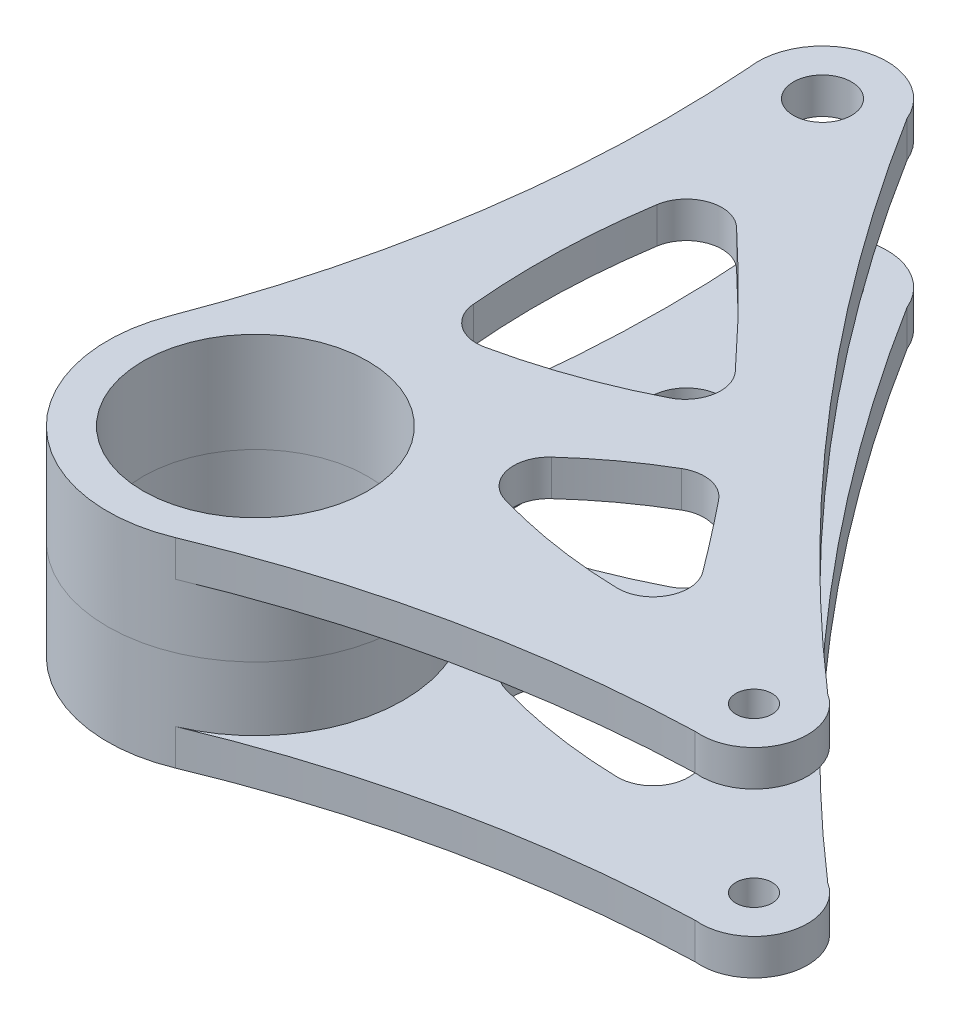
from build123d import *
from build123d.topology import SkipClean

# Parameters (mm, degrees)
SKETCH1_R           = 4.1
SKETCH1_R_2         = 15.8623
SKETCH1_R_3         = 2.55
BOSS_EXTRUDE1_DEPTH = 5.08
CUT_EXTRUDE1_DEPTH  = 118.648778806
FILLET1_R           = 5
BOSS_EXTRUDE2_START = 9
SKETCH2_R           = 15.8623
BOSS_EXTRUDE2_DEPTH = 9


with BuildPart() as part:
    # Sketch1 → Boss-Extrude1 (new body)
    with BuildSketch(Plane(origin=(0, 0, 0), x_dir=(1, 0, 0), z_dir=(0, 1, 0))):
        with BuildLine():
            ThreePointArc((6.92859567, 85.899539138), (-2.50515852, 88.74838161), (-9.001103193, 81.337961625))
            Line((-9.001103193, 81.337961625), (-20.635573093, 3.067357891))
            ThreePointArc((-20.635573093, 3.067357891), (-14.272359364, -15.21628468), (4.380807044, -20.397158894))
            Line((4.380807044, -20.397158894), (70.694507579, -6.154610316))
            ThreePointArc((70.694507579, -6.154610316), (76.259175154, -1.197614881), (74.857557701, 6.121729179))
            Line((74.857557701, 6.121729179), (6.92859567, 85.899539138))
        make_face()
        with Locations((0, 80)):
            Circle(SKETCH1_R, mode=Mode.SUBTRACT)
        Circle(SKETCH1_R_2, mode=Mode.SUBTRACT)
        with Locations((69.109107447, 1.227056598)):
            Circle(SKETCH1_R_3, mode=Mode.SUBTRACT)
    extrude(amount=BOSS_EXTRUDE1_DEPTH)

    # Sketch3 → Cut-Extrude1 (cut, through all)
    with BuildSketch(Plane(origin=(0, 5.08, 0), x_dir=(1, 0, 0), z_dir=(0, 1, 0))):
        with BuildLine():
            Line((74.857557701, 6.121729179), (6.92859567, 85.899539138))
            ThreePointArc((6.92859567, 85.899539138), (7.739936739, 84.785747516), (8.373803599, 83.562220274))
            ThreePointArc((8.373803599, 83.562220274), (37.931231119, 43.187947801), (73.125634893, 7.62002205))
            ThreePointArc((73.125634893, 7.62002205), (74.048734736, 6.936923693), (74.857557701, 6.121729179))
        make_face()
        with BuildLine():
            ThreePointArc((-8.993991676, 78.615040168), (-9.099968964, 79.9762334), (-9.001103193, 81.337961625))
            Line((-9.001103193, 81.337961625), (-20.635573093, 3.067357891))
            ThreePointArc((-20.635573093, 3.067357891), (-20.180913979, 5.28831469), (-19.487953881, 7.446825823))
            ThreePointArc((-19.487953881, 7.446825823), (-10.335992273, 42.455132152), (-8.993991676, 78.615040168))
        make_face()
        with BuildLine():
            Line((4.380807044, -20.397158894), (70.694507579, -6.154610316))
            ThreePointArc((70.694507579, -6.154610316), (69.513209705, -6.312121167), (68.321843219, -6.281785859))
            ThreePointArc((68.321843219, -6.281785859), (37.563201447, -10.050022698), (7.979797888, -19.275849837))
            ThreePointArc((7.979797888, -19.275849837), (6.205680629, -19.917958962), (4.380807044, -20.397158894))
        make_face()
        with BuildLine():
            ThreePointArc((19.080909655, 11.250219094), (36.663242325, 6.437712377), (54.889563885, 6.121729179))
            ThreePointArc((54.889563885, 6.121729179), (47.167735128, 16.666184237), (39.044241252, 26.904397902))
            ThreePointArc((39.044241252, 26.904397902), (28.24618646, 20.118426298), (19.080909655, 11.250219094))
        make_face()
        with BuildLine():
            ThreePointArc((3.041780229, 64.267991226), (0.175889719, 44.654135839), (1.12396198, 24.854696187))
            ThreePointArc((1.12396198, 24.854696187), (16.837219443, 28.774304989), (31.41631239, 35.825534821))
            ThreePointArc((31.41631239, 35.825534821), (17.651789409, 50.468496558), (3.041780229, 64.267991226))
        make_face()
    extrude(amount=-CUT_EXTRUDE1_DEPTH, mode=Mode.SUBTRACT)

    # Fillet1
    fillet1_edges = [part.edges().sort_by_distance(p)[0] for p in [
        (54.889563885, 2.54, -6.121729179),
        (19.080909655, 2.54, -11.250219094),
        (39.044241252, 2.54, -26.904397902),
        (31.41631239, 2.54, -35.825534821),
        (1.12396198, 2.54, -24.854696187),
        (3.041780229, 2.54, -64.267991226),
    ]]
    fillet(fillet1_edges, radius=FILLET1_R)

    # Sketch2 → Boss-Extrude2 (add)
    with SkipClean():  # the faces are left unmerged after this step: merging them gives an invalid solid
        with BuildSketch(Plane(origin=(0, 5.08, 0), x_dir=(1, 0, 0), z_dir=(0, 1, 0)).offset(BOSS_EXTRUDE2_START)):
            with BuildLine():
                ThreePointArc((7.979797888, -19.275849837), (17.345208254, -11.592209104), (20.8623, 0))
                ThreePointArc((20.8623, 0), (3.786292451, 20.515836585), (-19.487953881, 7.446825823))
                ThreePointArc((-19.487953881, 7.446825823), (-14.547672054, -14.953287234), (7.979797888, -19.275849837))
            make_face()
            Circle(SKETCH2_R, mode=Mode.SUBTRACT)
        extrude(amount=-BOSS_EXTRUDE2_DEPTH)


with BuildPart() as body_2:
    # Mirror1: mirrored copy
    add(part.part.mirror(Plane.ZX.offset(14.08)))


solid = Compound([part.part, body_2.part])
